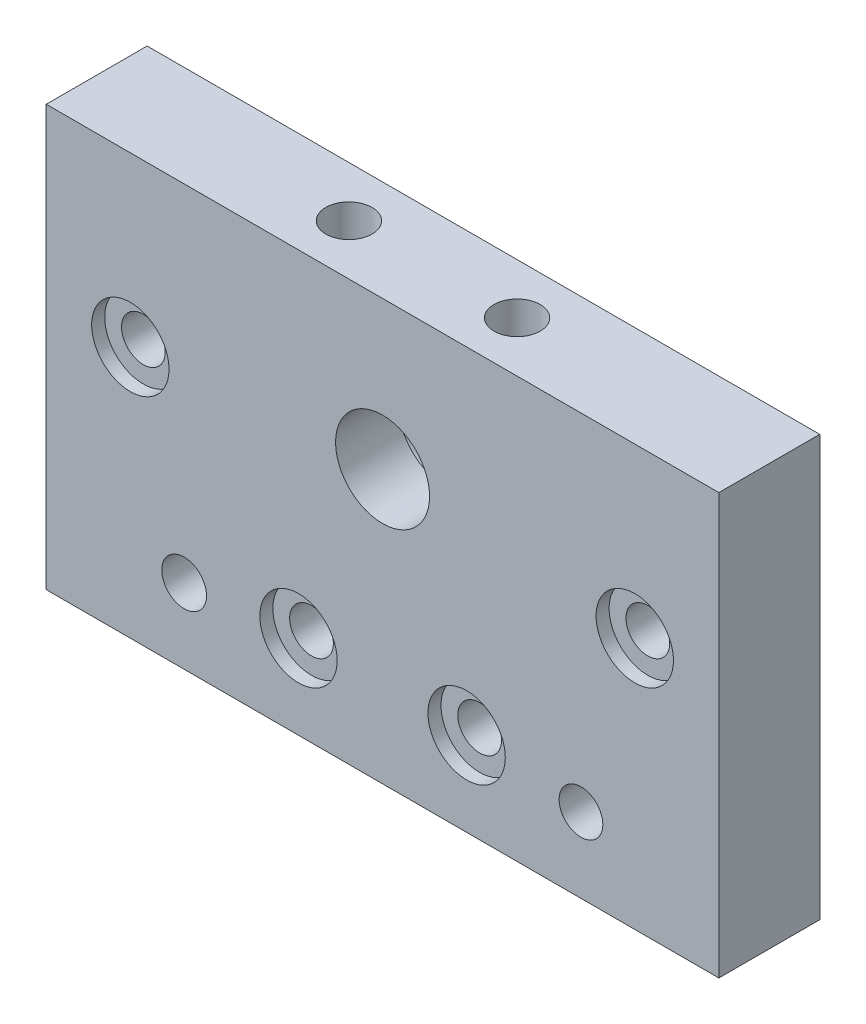
from build123d import *

# Parameters (mm, degrees)
CROQUIS1_W                       = 80
CROQUIS1_H                       = 50
CROQUIS1_R                       = 2.6
CROQUIS1_R_2                     = 5.59
CROQUIS1_R_3                     = 2.661703711
SALIENTE_EXTRUIR1_DEPTH          = 12
CROQUIS2_R                       = 4.6
CORTAR_EXTRUIR1_DEPTH            = 1.55
CROQUIS4_R                       = 8.05
CORTAR_EXTRUIR2_DEPTH            = 4.5
TALADRO_DE_MARGEN_PARA_M51_D     = 5.5
TALADRO_DE_MARGEN_PARA_M51_DEPTH = 10
TALADRO_DE_MARGEN_PARA_M51_TIP   = 1.652366702
TALADRO_DE_MARGEN_PARA_M52_D     = 5.5
TALADRO_DE_MARGEN_PARA_M52_DEPTH = 10
TALADRO_DE_MARGEN_PARA_M52_TIP   = 1.652366702


with BuildPart() as part:
    # Croquis1 → Saliente-Extruir1 (new body)
    with BuildSketch(Plane.XY):
        with Locations((40, 25)):
            Rectangle(CROQUIS1_W, CROQUIS1_H)
        with Locations((10, 30)):
            Circle(CROQUIS1_R, mode=Mode.SUBTRACT)
        with Locations((70, 30)):
            Circle(CROQUIS1_R, mode=Mode.SUBTRACT)
        with Locations((40, 32.4)):
            Circle(CROQUIS1_R_2, mode=Mode.SUBTRACT)
        with Locations((16.4, 8.9)):
            Circle(CROQUIS1_R_3, mode=Mode.SUBTRACT)
        with Locations((30, 10)):
            Circle(CROQUIS1_R, mode=Mode.SUBTRACT)
        with Locations((50, 10)):
            Circle(CROQUIS1_R, mode=Mode.SUBTRACT)
        with Locations((63.6, 8.9)):
            Circle(CROQUIS1_R, mode=Mode.SUBTRACT)
    extrude(amount=SALIENTE_EXTRUIR1_DEPTH)

    # Croquis2 → Cortar-Extruir1 (cut)
    with BuildSketch(Plane.XY.offset(12)):
        with Locations((10, 30)):
            Circle(CROQUIS2_R)
        with Locations((70, 30)):
            Circle(CROQUIS2_R)
        with Locations((30, 10)):
            Circle(CROQUIS2_R)
        with Locations((50, 10)):
            Circle(CROQUIS2_R)
    extrude(amount=-CORTAR_EXTRUIR1_DEPTH, mode=Mode.SUBTRACT)

    # Croquis4 → Cortar-Extruir2 (cut)
    with BuildSketch(Plane(origin=(0, 0, 0), x_dir=(-1, 0, 0), z_dir=(0, 0, -1))):
        with Locations((-40, 32.4)):
            Circle(CROQUIS4_R)
    extrude(amount=-CORTAR_EXTRUIR2_DEPTH, mode=Mode.SUBTRACT)

    # Taladro de margen para M51
    with Locations(Plane(origin=(30, 50, 6), x_dir=(0, 0, 1), z_dir=(0, 1, 0))):
        with Locations((0, 0)):
            Hole(TALADRO_DE_MARGEN_PARA_M51_D / 2, depth=TALADRO_DE_MARGEN_PARA_M51_DEPTH)
            with Locations((0, 0, -(TALADRO_DE_MARGEN_PARA_M51_DEPTH + TALADRO_DE_MARGEN_PARA_M51_TIP / 2))):  # 118° drill point
                Cone(0, TALADRO_DE_MARGEN_PARA_M51_D / 2, TALADRO_DE_MARGEN_PARA_M51_TIP, mode=Mode.SUBTRACT)

    # Taladro de margen para M52
    with Locations(Plane(origin=(50, 50, 6), x_dir=(0, 0, 1), z_dir=(0, 1, 0))):
        with Locations((0, 0)):
            Hole(TALADRO_DE_MARGEN_PARA_M52_D / 2, depth=TALADRO_DE_MARGEN_PARA_M52_DEPTH)
            with Locations((0, 0, -(TALADRO_DE_MARGEN_PARA_M52_DEPTH + TALADRO_DE_MARGEN_PARA_M52_TIP / 2))):  # 118° drill point
                Cone(0, TALADRO_DE_MARGEN_PARA_M52_D / 2, TALADRO_DE_MARGEN_PARA_M52_TIP, mode=Mode.SUBTRACT)


solid = part.part
